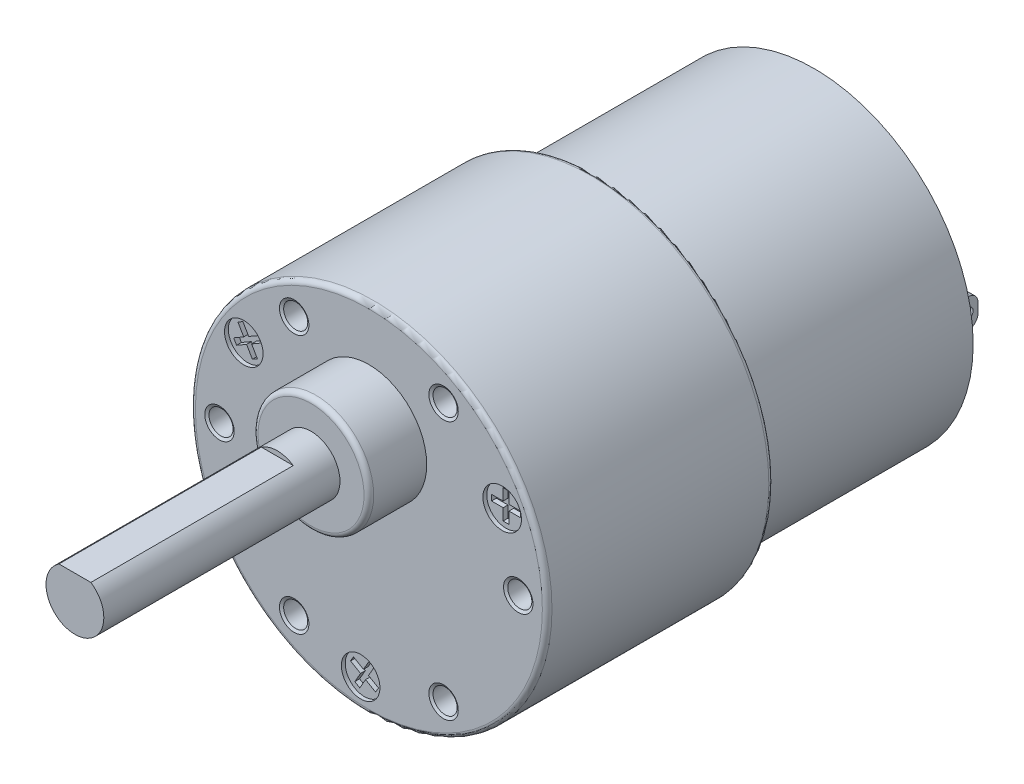
from build123d import *

# Parameters (mm, degrees)
SKETCH_1_R               = 16.5
EXTRUDE_1_DEPTH          = 22.7
SKETCH_2_R               = 18.5
EXTRUDE_2_DEPTH          = 23.5
SKETCH_3_R               = 6
EXTRUDE_3_DEPTH          = 6
SKETCH_4_R               = 3
EXTRUDE_4_DEPTH          = 15.5
CUT_EXTRUDE_START        = -12
CUT_EXTRUDE_1_DEPTH      = 12
SKETCH_6_W               = 1
SKETCH_6_H               = 3
EXTRUDE_5_DEPTH          = 3.5
SKETCH_7_R               = 1.5
EXTRUDE_6_DEPTH          = 1.5
SKETCH_8_R               = 0.5
CUT_EXTRUDE_2_DEPTH      = 78.133261308
FILLET_5_R               = 1
PATTERN_CIRCULAR_1_COUNT = 6
SKETCH_15_R              = 2
CUT_EXTRUDE_3_DEPTH      = 0.4
CUT_EXTRUDE_4_DEPTH      = 0.5
PATTERN_CIRCULAR_2_COUNT = 3
FILLET_6_R               = 0.5
SKETCH_18_R              = 16
CUT_EXTRUDE_5_DEPTH      = 0.6
FILLET_7_R               = 0.2
CHAMFER_1_SIZE           = 0.3
BOSS_EXTRUDE1_START      = -1
BOSS_EXTRUDE1_DEPTH      = 10


with BuildPart() as part:
    # 草图1 → 凸台-拉伸1 (new body)
    with BuildSketch(Plane.XY):
        Circle(SKETCH_1_R)
    extrude(amount=EXTRUDE_1_DEPTH)

    # 草图2 → 凸台-拉伸2 (add)
    with BuildSketch(Plane.XY.offset(22.7)):
        Circle(SKETCH_2_R)
    extrude(amount=EXTRUDE_2_DEPTH)

    # 草图3 → 凸台-拉伸3 (add)
    with BuildSketch(Plane.XY.offset(46.2)):
        with Locations((0, 7)):
            Circle(SKETCH_3_R)
    extrude(amount=EXTRUDE_3_DEPTH)

    # 草图4 → 凸台-拉伸4 (add)
    with BuildSketch(Plane.XY.offset(52.2)):
        with Locations((0, 7)):
            Circle(SKETCH_4_R)
    extrude(amount=EXTRUDE_4_DEPTH)

    # 草图5 → 切除-拉伸1 (cut)
    with BuildSketch(Plane.XY.offset(67.7).offset(CUT_EXTRUDE_START)):
        with BuildLine():
            Line((-1.658312395, 9.5), (1.658312395, 9.5))
            ThreePointArc((1.658312395, 9.5), (0, 10), (-1.658312395, 9.5))
        make_face()
    extrude(amount=CUT_EXTRUDE_1_DEPTH, mode=Mode.SUBTRACT)

    # 草图6 → 凸台-拉伸5 (add)
    with BuildSketch(Plane(origin=(0, 0, 0), x_dir=(-1, 0, 0), z_dir=(0, 0, -1))):
        with Locations((-13, 0)):
            Rectangle(SKETCH_6_W, SKETCH_6_H)
        with Locations((13, 0)):
            Rectangle(SKETCH_6_W, SKETCH_6_H)
    extrude(amount=EXTRUDE_5_DEPTH)

    # 草图7 → 凸台-拉伸6 (add)
    with BuildSketch(Plane(origin=(0, 0, 0), x_dir=(-1, 0, 0), z_dir=(0, 0, -1))):
        Circle(SKETCH_7_R)
    extrude(amount=EXTRUDE_6_DEPTH)

    # 草图8 → 切除-拉伸2 (cut, through all)
    with BuildSketch(Plane(origin=(13.5, 0, 0), x_dir=(0, 0, -1), z_dir=(1, 0, 0))):
        with Locations((2.5, 0)):
            Circle(SKETCH_8_R)
    extrude(amount=-CUT_EXTRUDE_2_DEPTH, mode=Mode.SUBTRACT)

    # 圆角5
    fillet_5_edges = [part.edges().sort_by_distance(p)[0] for p in [
        (-13, 1.5, -3.5),
        (-13, -1.5, -3.5),
        (13, 1.5, -3.5),
        (13, -1.5, -3.5),
    ]]
    fillet(fillet_5_edges, radius=FILLET_5_R)

    # 草图13 → M3 螺纹孔3 (revolve, cut)
    with BuildSketch(Plane(origin=(7.75, 13.423393759, 46.2), x_dir=(0, -1, 0), z_dir=(1, 0, 0))):
        Polygon((0, 0), (0, 7.251075774), (1.25, 6.5), (1.25, 0.158771324), (1.525, 0), align=None)
    hole_wizard_m3_3 = revolve(axis=Axis((7.75, 13.423393759, 52.55), (0, 0, -1)), mode=Mode.SUBTRACT)

    # 阵列(圆周)1: M3 螺纹孔3 ×6 about axis
    pattern_circular_1_axis = Axis((0, 0, -7.35), (0, 0, 1))
    for i in range(1, PATTERN_CIRCULAR_1_COUNT):
        add(hole_wizard_m3_3.rotate(pattern_circular_1_axis, i * 360 / PATTERN_CIRCULAR_1_COUNT), mode=Mode.SUBTRACT)

    # 草图15 → 切除-拉伸3 (cut)
    with BuildSketch(Plane.XY.offset(46.2)):
        with Locations((13.829316686, 7)):
            Circle(SKETCH_15_R)
    cut_extrude_3 = extrude(amount=-CUT_EXTRUDE_3_DEPTH, mode=Mode.SUBTRACT)

    # 草图17 → 切除-拉伸4 (cut)
    with BuildSketch(Plane.XY.offset(45.8)):
        Polygon((13.529316686, 5.5), (13.529316686, 6.7), (12.329316686, 6.7), (12.329316686, 7.3), (13.529316686, 7.3), (13.529316686, 8.5), (14.129316686, 8.5), (14.129316686, 7.3), (15.329316686, 7.3), (15.329316686, 6.7), (14.129316686, 6.7), (14.129316686, 5.5), align=None)
    cut_extrude_4 = extrude(amount=-CUT_EXTRUDE_4_DEPTH, mode=Mode.SUBTRACT)

    # 阵列(圆周)2: 切除-拉伸3, 切除-拉伸4 ×3 about axis
    pattern_circular_2_axis = Axis((0, 0, -7.35), (0, 0, 1))
    add([cut_extrude_3.rotate(pattern_circular_2_axis, i * 360 / PATTERN_CIRCULAR_2_COUNT) for i in range(1, PATTERN_CIRCULAR_2_COUNT)], mode=Mode.SUBTRACT)
    add([cut_extrude_4.rotate(pattern_circular_2_axis, i * 360 / PATTERN_CIRCULAR_2_COUNT) for i in range(1, PATTERN_CIRCULAR_2_COUNT)], mode=Mode.SUBTRACT)

    # 圆角6
    fillet_6_edges = [part.edges().sort_by_distance(p)[0] for p in [
        (-6, 7, 52.2),
        (-18.5, 0, 46.2),
        (-18.5, 0, 22.7),
    ]]
    fillet(fillet_6_edges, radius=FILLET_6_R)

    # 草图18 → 切除-拉伸5 (cut)
    with BuildSketch(Plane(origin=(0, 0, 0), x_dir=(-1, 0, 0), z_dir=(0, 0, -1))):
        Circle(SKETCH_18_R)
    extrude(amount=-CUT_EXTRUDE_5_DEPTH, mode=Mode.SUBTRACT)


with BuildPart() as cut_extrude_5_piece_1:
    # of the separate pieces the step leaves, piece 1, a body of its own (cut_extrude_5_pieces)
    add(part.part.solids().sort_by_distance((18, 0, 22.7))[0])

    # 倒角1
    chamfer_1_edges = [cut_extrude_5_piece_1.edges().sort_by_distance(p)[0] for p in [
        (0, 9.5, 67.7),
        (-1.418637165, 4.356617963, 67.7),
    ]]
    chamfer(chamfer_1_edges, length=CHAMFER_1_SIZE)

    # Sketch1 → Boss-Extrude1 (add)
    with BuildSketch(Plane.XY.offset(67.7).offset(BOSS_EXTRUDE1_START)):
        with BuildLine():
            Line((1.658312395, 9.5), (-1.658312395, 9.5))
            ThreePointArc((-1.658312395, 9.5), (0, 4), (1.658312395, 9.5))
        make_face()
    extrude(amount=BOSS_EXTRUDE1_DEPTH)


with BuildPart() as cut_extrude_5_piece_2:
    # of the separate pieces the step leaves, piece 2, a body of its own (cut_extrude_5_pieces)
    add(part.part.solids().sort_by_distance((-1.5, 0, 0))[0])

    # 圆角7
    fillet_7_edges = [cut_extrude_5_piece_2.edges().sort_by_distance(p)[0] for p in [
        (1.5, 0, -1.5),
    ]]
    fillet(fillet_7_edges, radius=FILLET_7_R)


with BuildPart() as cut_extrude_5_piece_3:
    # of the separate pieces the step leaves, piece 3, a body of its own (cut_extrude_5_pieces)
    add(part.part.solids().sort_by_distance((13.5, 1.5, -2.5))[0])


with BuildPart() as cut_extrude_5_piece_4:
    # of the separate pieces the step leaves, piece 4, a body of its own (cut_extrude_5_pieces)
    add(part.part.solids().sort_by_distance((-13.5, 1.5, -2.5))[0])


solid = Compound([cut_extrude_5_piece_1.part, cut_extrude_5_piece_2.part, cut_extrude_5_piece_3.part, cut_extrude_5_piece_4.part])
